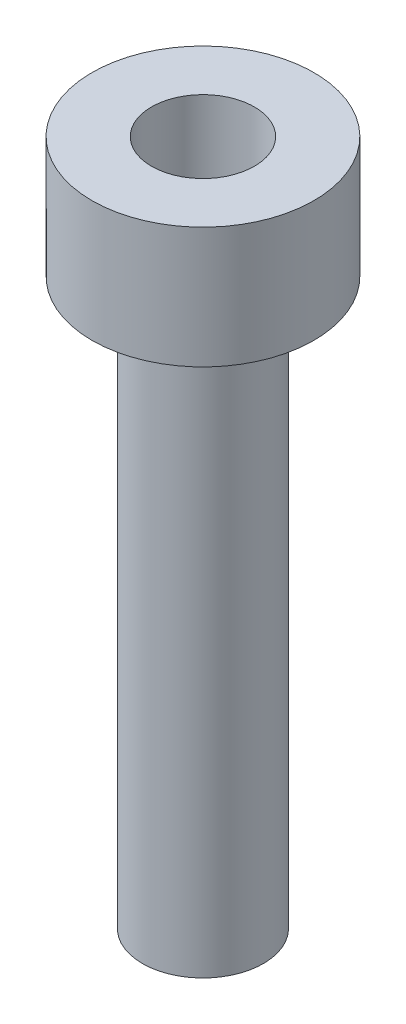
from build123d import *

# Parameters (mm, degrees)
SKETCH1_R    = 2.75
HEAD_DEPTH   = 3
SHANK_START  = -14
SKETCH2_R    = 1.5
SHANK_DEPTH  = 14
SOCKET_START = 3
SKETCH3_R    = 1.275
SOCKET_DEPTH = 1.8


with BuildPart() as part:
    # Sketch1 → Head (new body)
    with BuildSketch(Plane(origin=(0, 0, 0), x_dir=(1, 0, 0), z_dir=(0, 1, 0))):
        with Locations(Location((0, 0, 0), (0, 0, 270))):
            Circle(SKETCH1_R)
    extrude(amount=HEAD_DEPTH)

    # Sketch2 → Shank (add)
    with BuildSketch(Plane(origin=(0, 0, 0), x_dir=(1, 0, 0), z_dir=(0, 1, 0)).offset(SHANK_START)):
        with Locations(Location((0, 0, 0), (0, 0, 270))):
            Circle(SKETCH2_R)
    extrude(amount=SHANK_DEPTH)

    # Sketch3 → Socket (cut)
    with BuildSketch(Plane(origin=(0, 0, 0), x_dir=(1, 0, 0), z_dir=(0, 1, 0)).offset(SOCKET_START)):
        with Locations(Location((0, 0, 0), (0, 0, 270))):
            Circle(SKETCH3_R)
    extrude(amount=-SOCKET_DEPTH, mode=Mode.SUBTRACT)


solid = part.part
